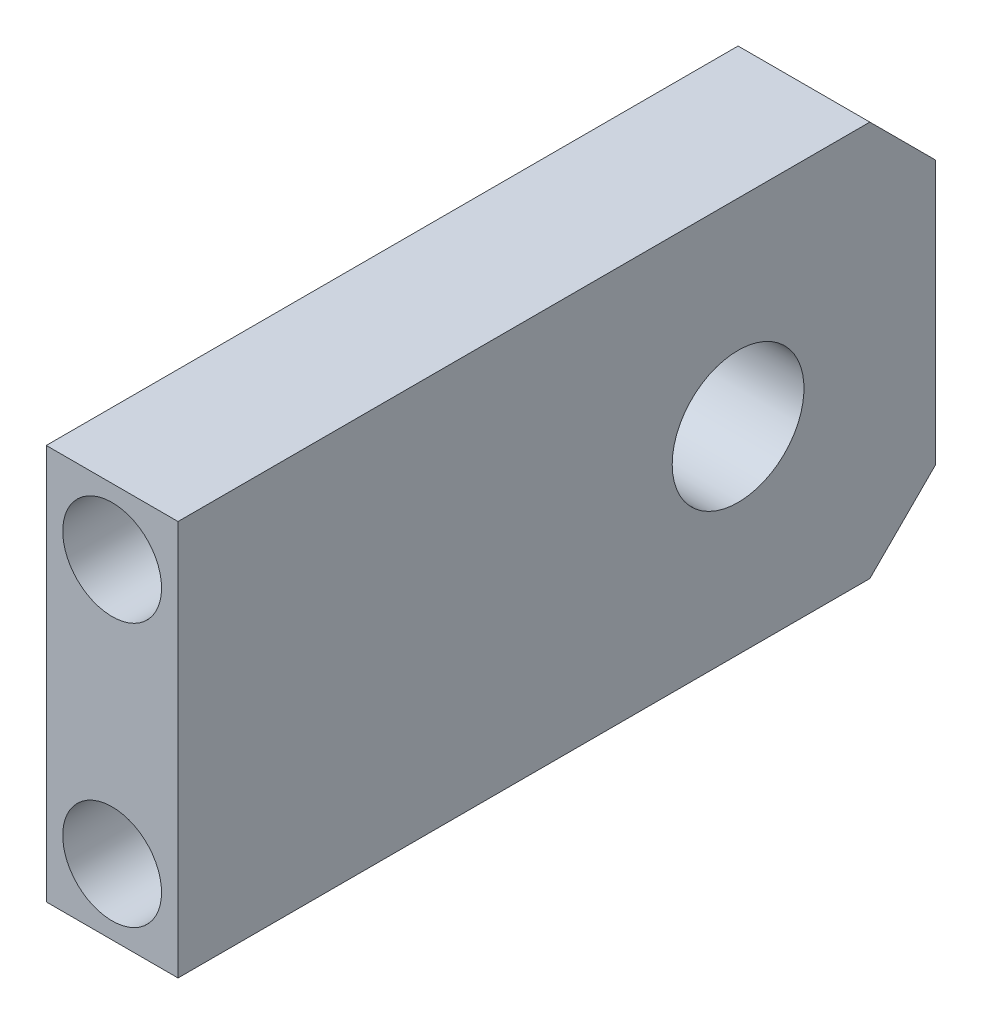
from build123d import *

# Parameters (mm, degrees)
SKETCH3_W           = 23
SKETCH3_H           = 12
BOSS_EXTRUDE1_DEPTH = 4
SKETCH7_R           = 1.5
CUT_EXTRUDE1_DEPTH  = 10
SKETCH8_R           = 2
CUT_EXTRUDE2_DEPTH  = 27.248809497
CHAMFER1_SIZE       = 2


with BuildPart() as part:
    # Sketch3 → Boss-Extrude1 (new body)
    with BuildSketch(Plane(origin=(0, 0, 0), x_dir=(0, 0, -1), z_dir=(1, 0, 0))):
        with Locations((11.5, -6)):
            Rectangle(SKETCH3_W, SKETCH3_H)
    extrude(amount=BOSS_EXTRUDE1_DEPTH)

    # Sketch7 → Cut-Extrude1 (cut)
    with BuildSketch(Plane.XY):
        with Locations((2, -2)):
            Circle(SKETCH7_R)
        with Locations((2, -10)):
            Circle(SKETCH7_R)
    extrude(amount=-CUT_EXTRUDE1_DEPTH, mode=Mode.SUBTRACT)

    # Sketch8 → Cut-Extrude2 (cut, through all)
    with BuildSketch(Plane.ZY):
        with Locations((-17, -6)):
            Circle(SKETCH8_R)
    extrude(amount=-CUT_EXTRUDE2_DEPTH, mode=Mode.SUBTRACT)

    # Chamfer1
    chamfer1_edges = [part.edges().sort_by_distance(p)[0] for p in [
        (2, 0, -23),
        (2, -12, -23),
    ]]
    chamfer(chamfer1_edges, length=CHAMFER1_SIZE)


solid = part.part
